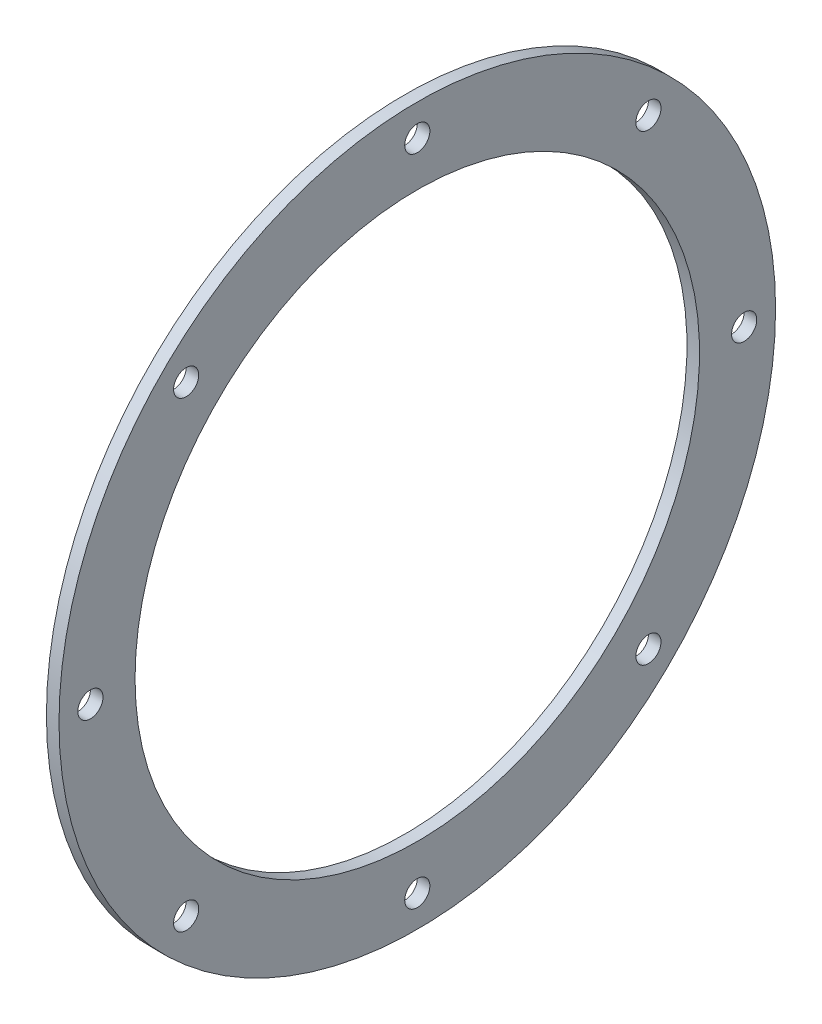
from build123d import *

# Parameters (mm, degrees)
SKETCH2_W          = 2
SKETCH2_H          = 12.1
SKETCH3_R          = 2
CUT_EXTRUDE1_DEPTH = 10
CIRPATTERN1_COUNT  = 8


with BuildPart() as part:
    # Sketch2 → Revolve1 (revolve)
    with BuildSketch(Plane.XY, mode=Mode.PRIVATE) as revolve1_sk:
        with Locations((10.74983843, 50.95)):
            Rectangle(SKETCH2_W, SKETCH2_H)
    revolve(revolve1_sk.sketch.rotate(Axis((-478.111946857, 0, 0), (1, 0, 0)), 90), axis=Axis((-478.111946857, 0, 0), (1, 0, 0)))

    # Sketch3 → Cut-Extrude1 (cut)
    with BuildSketch(Plane.ZY.offset(-9.74983843)):
        with Locations((0, 52)):
            Circle(SKETCH3_R)
    cut_extrude1 = extrude(amount=-CUT_EXTRUDE1_DEPTH, mode=Mode.SUBTRACT)

    # CirPattern1: Cut-Extrude1 ×8 about axis
    cirpattern1_axis = Axis((0, 0, 0), (1, 0, 0))
    for i in range(1, CIRPATTERN1_COUNT):
        add(cut_extrude1.rotate(cirpattern1_axis, i * 360 / CIRPATTERN1_COUNT), mode=Mode.SUBTRACT)


solid = part.part
